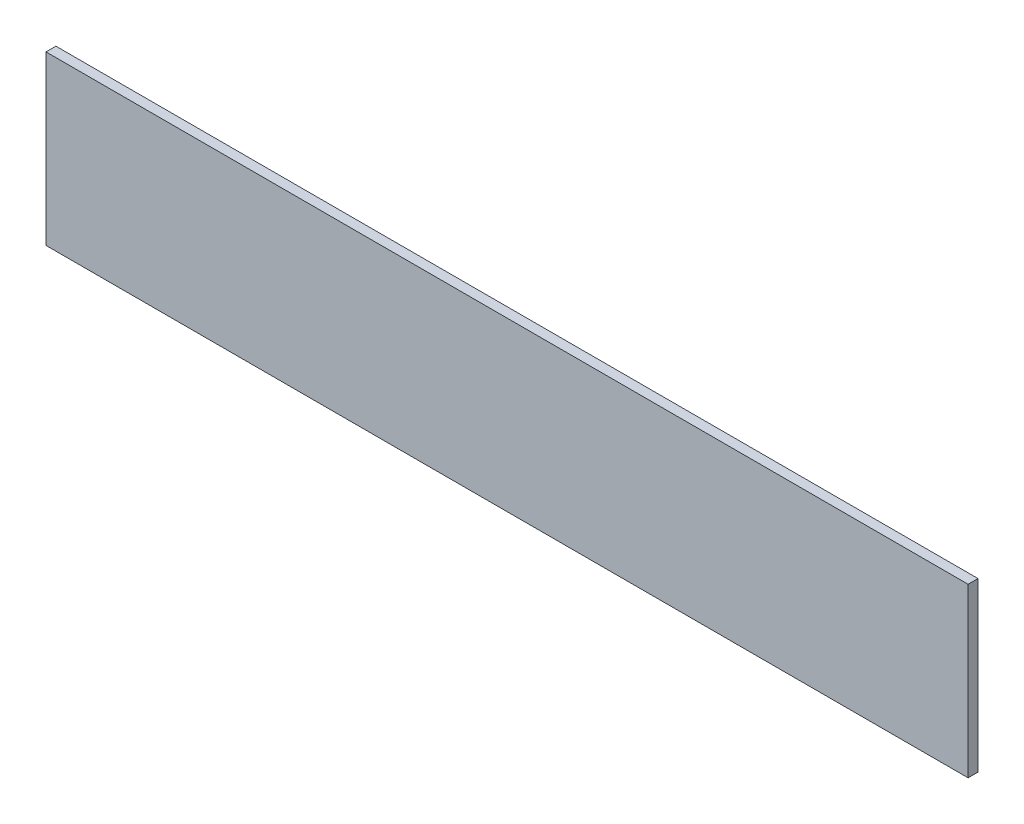
from build123d import *

# Parameters (mm, degrees)
SKETCH1_W           = 279.4
SKETCH1_H           = 50.8
BOSS_EXTRUDE1_DEPTH = 3


with BuildPart() as part:
    # Sketch1 → Boss-Extrude1 (new body)
    with BuildSketch(Plane.XY):
        with Locations((139.7, 25.4)):
            Rectangle(SKETCH1_W, SKETCH1_H)
    extrude(amount=BOSS_EXTRUDE1_DEPTH)


solid = part.part
